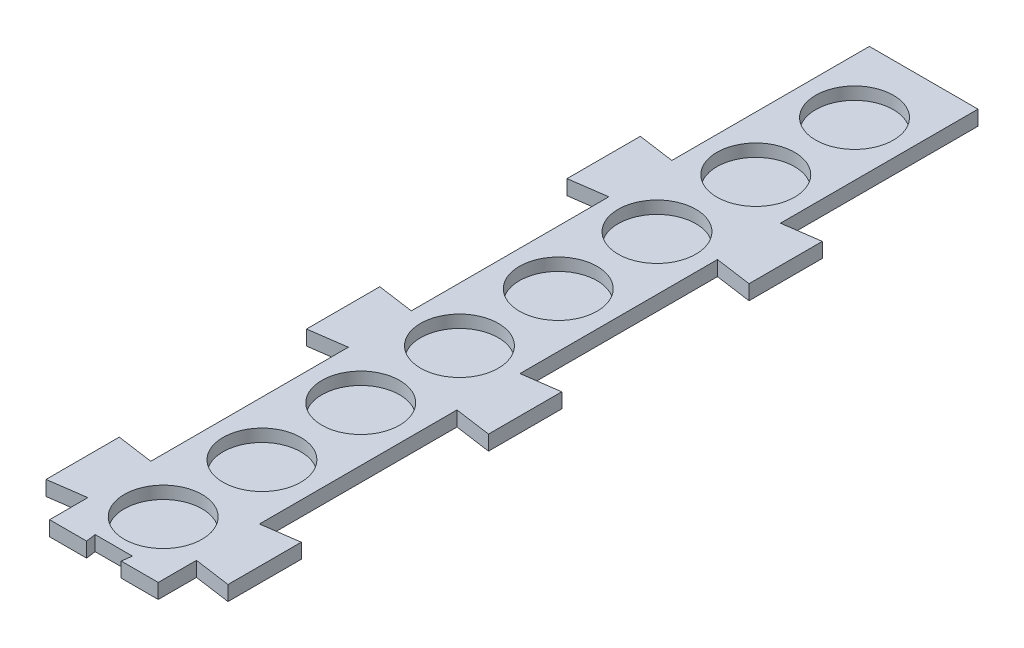
from build123d import *

# Parameters (mm, degrees)
SKETCH1_W           = 27.94
SKETCH1_H           = 391.16
BOSS_EXTRUDE1_DEPTH = 3.81
SKETCH2_R           = 10
CUT_EXTRUDE1_DEPTH  = 3.21
BOSS_EXTRUDE2_DEPTH = 3.81
SKETCH5_W           = 46.80460671
SKETCH5_H           = 4.064
CUT_EXTRUDE2_DEPTH  = 182.88
BOSS_EXTRUDE3_DEPTH = 3.81


with BuildPart() as part:
    # Sketch1 → Boss-Extrude1 (new body)
    with BuildSketch(Plane(origin=(0, 0, 0), x_dir=(1, 0, 0), z_dir=(0, 1, 0))):
        Rectangle(SKETCH1_W, SKETCH1_H)
    extrude(amount=BOSS_EXTRUDE1_DEPTH)

    # Sketch2 → Cut-Extrude1 (cut)
    with BuildSketch(Plane(origin=(0, 3.81, 0), x_dir=(1, 0, 0), z_dir=(0, 1, 0))):
        with Locations((0, 177.8)):
            Circle(SKETCH2_R)
        with Locations((0, 152.4)):
            Circle(SKETCH2_R)
        with Locations((0, 127)):
            Circle(SKETCH2_R)
        with Locations((0, 101.6)):
            Circle(SKETCH2_R)
        with Locations((0, 76.2)):
            Circle(SKETCH2_R)
        with Locations((0, 50.8)):
            Circle(SKETCH2_R)
        with Locations((0, 25.4)):
            Circle(SKETCH2_R)
        Circle(SKETCH2_R)
        with Locations((0, -25.4)):
            Circle(SKETCH2_R)
        with Locations((0, -50.8)):
            Circle(SKETCH2_R)
        with Locations((0, -76.2)):
            Circle(SKETCH2_R)
        with Locations((0, -101.6)):
            Circle(SKETCH2_R)
        with Locations((0, -127)):
            Circle(SKETCH2_R)
        with Locations((0, -152.4)):
            Circle(SKETCH2_R)
        with Locations((0, -177.8)):
            Circle(SKETCH2_R)
    extrude(amount=-CUT_EXTRUDE1_DEPTH, mode=Mode.SUBTRACT)

    # Sketch4 → Boss-Extrude2 (add)
    with BuildSketch(Plane(origin=(0, 0, 0), x_dir=(1, 0, 0), z_dir=(0, 1, 0))):
        Polygon((23.402303355, -54.881033493), (13.97, -56.20665728), (13.97, -72.402209707), (23.402303355, -73.727833493), align=None)
        Polygon((23.402303355, 146.105623787), (13.97, 144.78), (13.97, 128.584447573), (23.402303355, 127.258823787), align=None)
        Polygon((-13.97, 128.584447573), (-13.97, 144.78), (-23.402303355, 146.105623787), (-23.402303355, 127.258823787), align=None)
        Polygon((23.402303355, 79.11007136), (13.97, 77.784447573), (13.97, 61.588895147), (23.402303355, 60.26327136), align=None)
        Polygon((23.402303355, 12.114518933), (13.97, 10.788895147), (13.97, -5.40665728), (23.402303355, -6.732281067), align=None)
        Polygon((-13.97, -5.40665728), (-13.97, 10.788895147), (-23.402303355, 12.114518933), (-23.402303355, -6.732281067), align=None)
        Polygon((-13.97, 61.588895147), (-13.97, 77.784447573), (-23.402303355, 79.11007136), (-23.402303355, 60.26327136), align=None)
        Polygon((23.402303355, -121.87658592), (13.97, -123.202209707), (13.97, -139.397762134), (23.402303355, -140.72338592), align=None)
        Polygon((-13.97, -139.397762134), (-13.97, -123.202209707), (-23.402303355, -121.87658592), (-23.402303355, -140.72338592), align=None)
        Polygon((-13.97, -72.402209707), (-13.97, -56.20665728), (-23.402303355, -54.881033493), (-23.402303355, -73.727833493), align=None)
    extrude(amount=BOSS_EXTRUDE2_DEPTH)

    # Sketch5 → Cut-Extrude2 (cut)
    with BuildSketch(Plane.XY.offset(195.58)):
        with Locations((0, 2.032)):
            Rectangle(SKETCH5_W, SKETCH5_H)
    extrude(amount=-CUT_EXTRUDE2_DEPTH, mode=Mode.SUBTRACT)

    # Sketch6 → Boss-Extrude3 (add)
    with BuildSketch(Plane(origin=(0, 3.81, 0), x_dir=(1, 0, 0), z_dir=(0, 1, 0))):
        Polygon((-4.80197372, -12.7), (-4.445, -15.24), (-13.97, -15.24), (-13.97, -12.7), align=None)
        Polygon((13.97, -12.7), (13.97, -15.24), (4.445, -15.24), (4.80197372, -12.7), align=None)
    extrude(amount=-BOSS_EXTRUDE3_DEPTH)


solid = part.part
